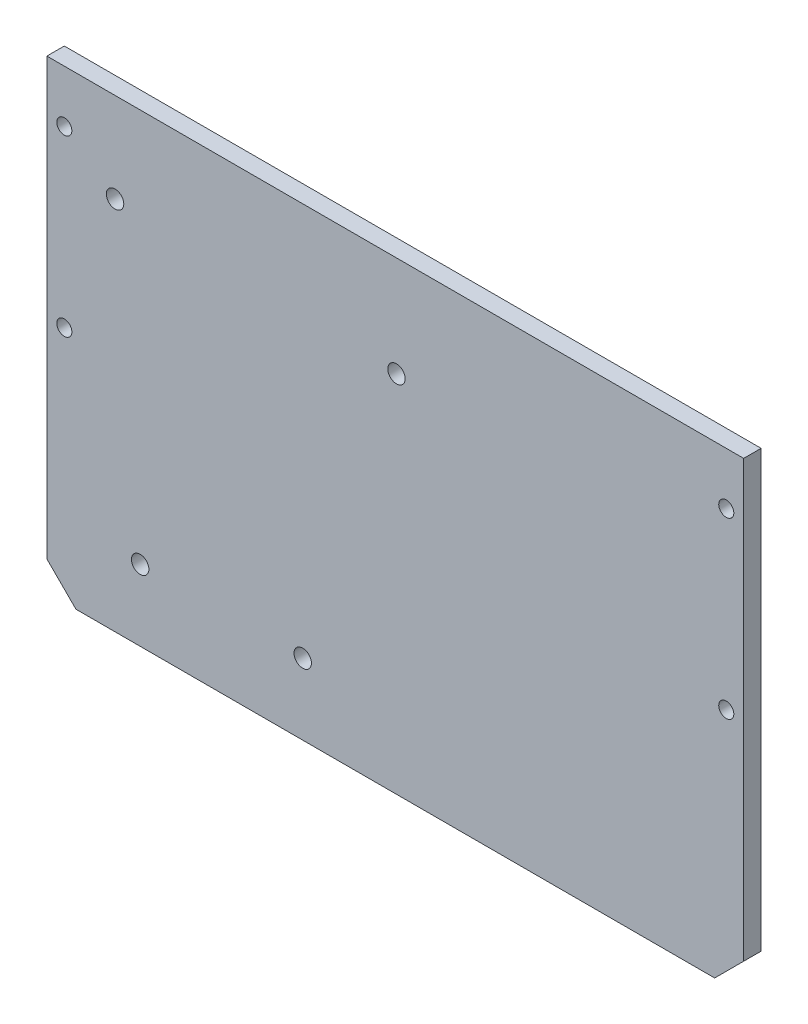
from build123d import *

# Parameters (mm, degrees)
SKETCH_1_W          = 120
SKETCH_1_H          = 80
EXTRUDE_1_DEPTH     = 3
SKETCH_2_R          = 1.3
CUT_EXTRUDE_1_DEPTH = 73.173402303
SKETCH_3_R          = 1.5
CUT_EXTRUDE_2_DEPTH = 73.173402303
CHAMFER_1_SIZE      = 5


with BuildPart() as part:
    # 草图1 → 凸台-拉伸1 (new body)
    with BuildSketch(Plane.XY):
        Rectangle(SKETCH_1_W, SKETCH_1_H)
    extrude(amount=EXTRUDE_1_DEPTH)

    # 草图2 → 切除-拉伸1 (cut, through all)
    with BuildSketch(Plane.XY.offset(3)):
        with Locations((-57, 31)):
            Circle(SKETCH_2_R)
        with Locations((-57, 1)):
            Circle(SKETCH_2_R)
        with Locations(Location((57, 31, 0), (0, 0, 180))):
            Circle(SKETCH_2_R)
        with Locations(Location((57, 1, 0), (0, 0, 180))):
            Circle(SKETCH_2_R)
    extrude(amount=-CUT_EXTRUDE_1_DEPTH, mode=Mode.SUBTRACT)

    # 草图3 → 切除-拉伸2 (cut, through all)
    with BuildSketch(Plane.XY.offset(3)):
        with Locations((-43.937436438, -27.771775862)):
            Circle(SKETCH_3_R)
        with Locations((-15.937436438, -27.771775862)):
            Circle(SKETCH_3_R)
        with Locations((-48.258865009, 24.55006714)):
            Circle(SKETCH_3_R)
        with Locations((0.206206662, 22.7097335)):
            Circle(SKETCH_3_R)
    extrude(amount=-CUT_EXTRUDE_2_DEPTH, mode=Mode.SUBTRACT)

    # 倒角1
    chamfer_1_edges = [part.edges().sort_by_distance(p)[0] for p in [
        (60, -40, 1.5),
        (-60, -40, 1.5),
    ]]
    chamfer(chamfer_1_edges, length=CHAMFER_1_SIZE)


solid = part.part
